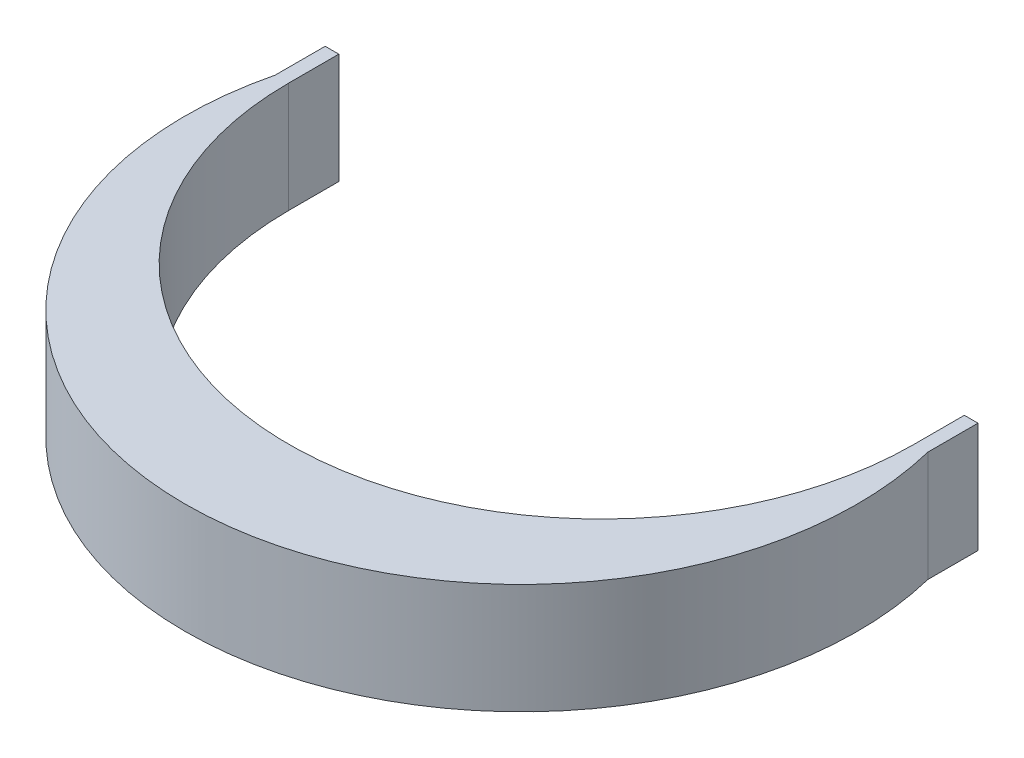
from build123d import *

# Parameters (mm, degrees)
SKETCH1_W             = 0.34
SKETCH1_H             = 2.75
BOSS_EXTRUDE1_DEPTH   = 1.25
SKETCH1_W_2           = 0.339999955
BOSS_EXTRUDE1_2_DEPTH = 1.25
BOSS_EXTRUDE2_DEPTH   = 2.75


with BuildPart() as part:
    # Sketch1 → Boss-Extrude1 (new body)
    with BuildSketch(Plane.XY):
        with Locations((-0.17, 1.375)):
            Rectangle(SKETCH1_W, SKETCH1_H)
    extrude(amount=BOSS_EXTRUDE1_DEPTH)



with BuildPart() as body_2:
    # Sketch1 → Boss-Extrude1 2 (new body)
    with BuildSketch(Plane.XY):
        with Locations((15.759999978, 1.375)):
            Rectangle(SKETCH1_W_2, SKETCH1_H)
    extrude(amount=BOSS_EXTRUDE1_2_DEPTH)


with BuildPart() as part_1:
    add(part.part)

    add(body_2.part)  # Boss-Extrude2 merges body 2
    # Sketch2 → Boss-Extrude2 (add)
    with BuildSketch(Plane(origin=(0, 2.75, 0), x_dir=(1, 0, 0), z_dir=(0, 1, 0))):
        with BuildLine():
            Line((-0.339999955, -1.25), (0, -1.25))
            ThreePointArc((0, -1.25), (7.795, -9.045), (15.59, -1.25))
            Line((15.59, -1.25), (15.929999955, -1.25))
            ThreePointArc((15.929999955, -1.25), (7.795, -11.627244432), (-0.339999955, -1.25))
        make_face()
    extrude(amount=-BOSS_EXTRUDE2_DEPTH)


solid = part_1.part
